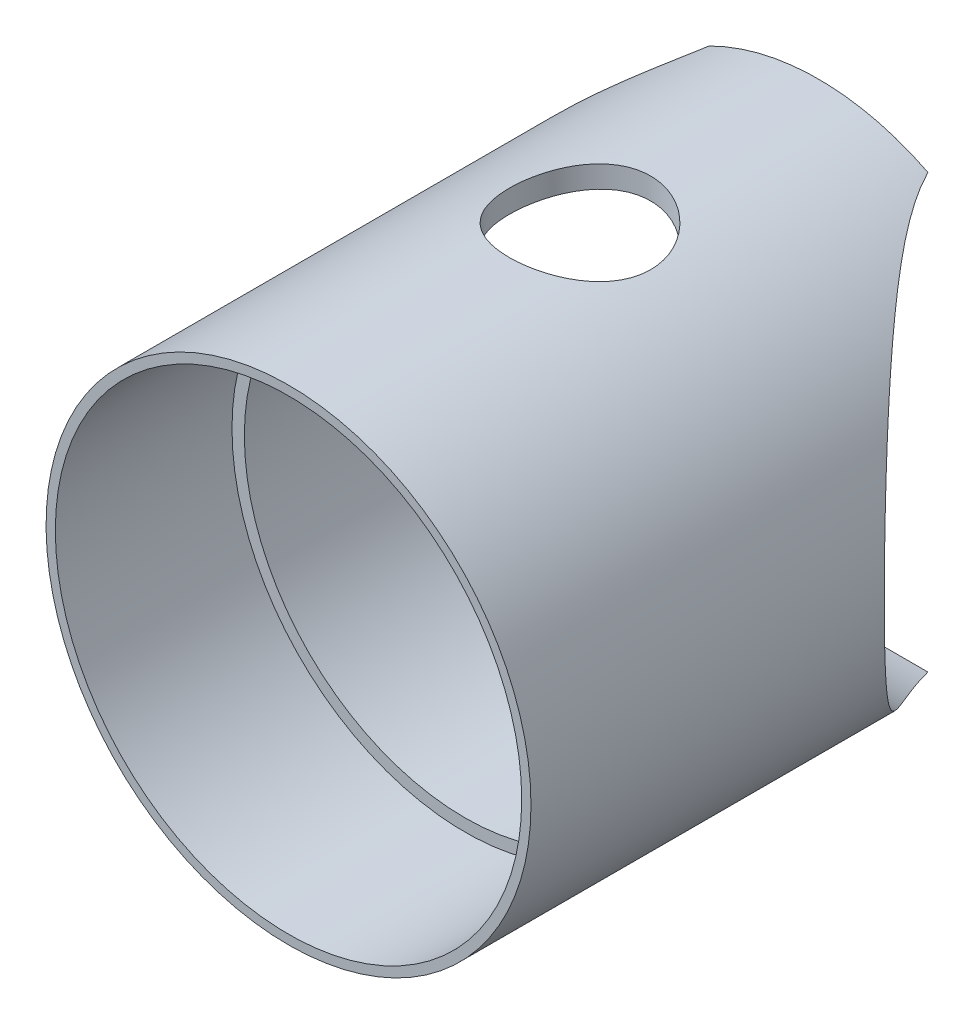
from build123d import *

# Parameters (mm, degrees)
SKETCH2_R               = 34.8615
SKETCH2_R_2             = 33.528
BOSS_EXTRUDE1_DEPTH     = 25.4
BOSS_EXTRUDE2_START     = 50.8
SKETCH3_R               = 34.8615
BOSS_EXTRUDE2_DEPTH     = 50.8
SKETCH4_R               = 31.75
CUT_EXTRUDE2_DEPTH      = 94.044402901
SKETCH6_R               = 31.75
CUT_EXTRUDE4_DEPTH      = 50.8
CUT_EXTRUDE5_REACH      = 95.044
CUT_EXTRUDE5_END_RADIUS = 31.75
SKETCH7_R               = 10.16


with BuildPart() as part:
    # Sketch2 → Boss-Extrude1 (new body)
    with BuildSketch(Plane.XY):
        Circle(SKETCH2_R)
        Circle(SKETCH2_R_2, mode=Mode.SUBTRACT)
    extrude(amount=BOSS_EXTRUDE1_DEPTH)

    # Sketch3 → Boss-Extrude2 (add)
    with BuildSketch(Plane(origin=(0, 0, 0), x_dir=(-1, 0, 0), z_dir=(0, 0, -1)).offset(BOSS_EXTRUDE2_START)):
        Circle(SKETCH3_R)
    extrude(amount=-BOSS_EXTRUDE2_DEPTH)

    # Sketch4 → Cut-Extrude2 (cut, through all)
    with BuildSketch(Plane(origin=(34.8615, 0, 0), x_dir=(0, 0, -1), z_dir=(1, 0, 0))):
        with Locations((57.15, 0)):
            Circle(SKETCH4_R)
    extrude(amount=-CUT_EXTRUDE2_DEPTH, mode=Mode.SUBTRACT)

    # Sketch6 → Cut-Extrude4 (cut)
    with BuildSketch(Plane.XY):
        Circle(SKETCH6_R)
    extrude(amount=-CUT_EXTRUDE4_DEPTH, mode=Mode.SUBTRACT)

    # Cut-Extrude5: up to this cylinder (the profile starts outside it)
    cut_extrude5_end = Plane(origin=(0, 0, -16.51), z_dir=(0, 0, 1)) * Cylinder(CUT_EXTRUDE5_END_RADIUS, 254.588, mode=Mode.PRIVATE)
    # Sketch7 → Cut-Extrude5 (cut, up to the surface)
    with BuildSketch(Plane(origin=(0, 34.8615, 0), x_dir=(-1, 0, 0), z_dir=(0, 1, 0)), mode=Mode.PRIVATE) as cut_extrude5_sk1:
        with Locations(Location((0, -16.51, 0), (0, 0, 90))):
            Circle(SKETCH7_R)
    cut_extrude5_tool1 = extrude(cut_extrude5_sk1.sketch, amount=-CUT_EXTRUDE5_REACH, mode=Mode.PRIVATE) - cut_extrude5_end
    add(cut_extrude5_tool1.solids().sort_by_distance((0, 34.8615, -16.51))[0], mode=Mode.SUBTRACT)


solid = part.part
